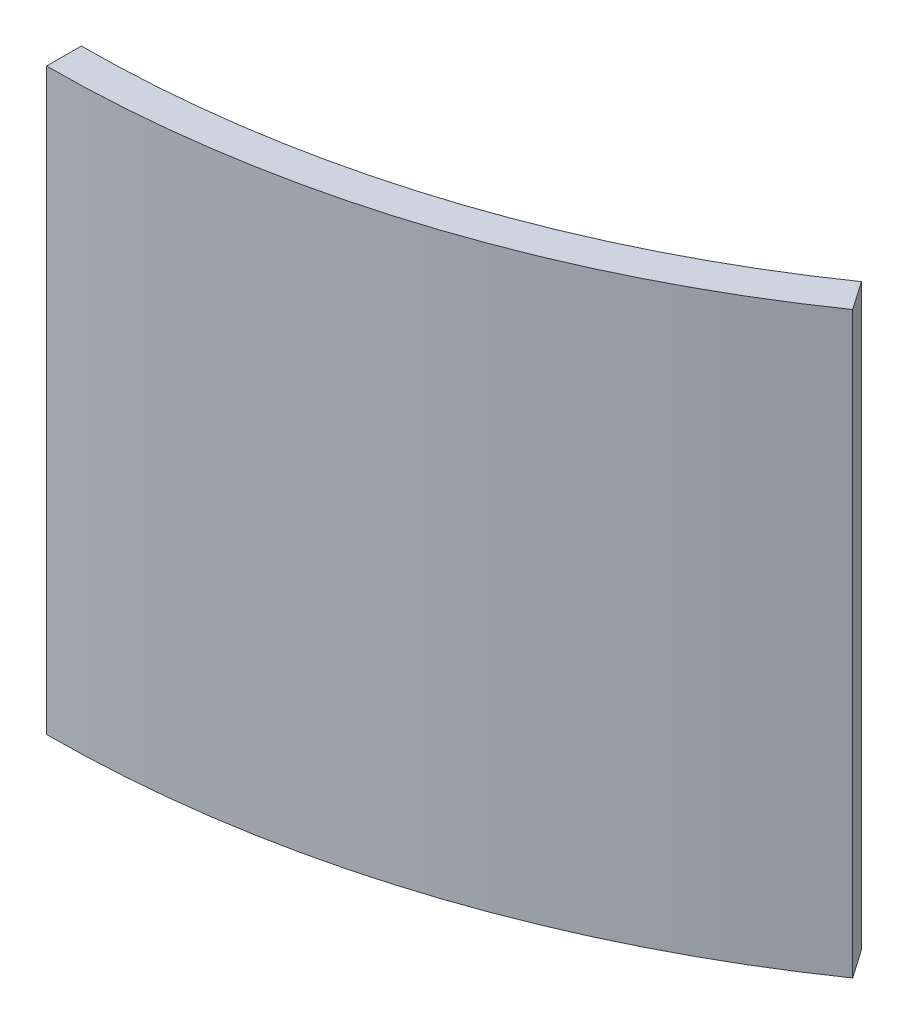
from build123d import *

# Parameters (mm, degrees)
BOSS_EXTRUDE1_DEPTH = 50


with BuildPart() as part:
    # Sketch1 → Boss-Extrude1 (new body)
    with BuildSketch(Plane(origin=(0, 0, 0), x_dir=(1, 0, 0), z_dir=(0, 1, 0))):
        with BuildLine():
            Line((0, -90), (0, -93))
            ThreePointArc((0, -93), (27.781669263, -88.753472343), (53.026228271, -76.401695763))
            Line((53.026228271, -76.401695763), (51.315704778, -73.937124932))
            ThreePointArc((51.315704778, -73.937124932), (26.885486384, -85.890457106), (0, -90))
        make_face()
    extrude(amount=BOSS_EXTRUDE1_DEPTH)


solid = part.part
